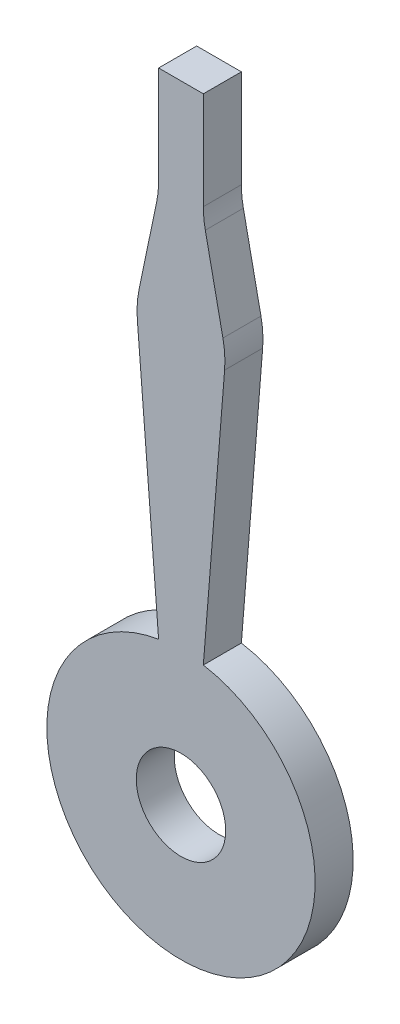
from build123d import *

# Parameters (mm, degrees)
BOSS_EXTRUDE1_DEPTH = 4


with BuildPart() as part:
    # Sketch1 → Boss-Extrude1 (new body)
    with BuildSketch(Plane.XY):
        with BuildLine():
            ThreePointArc((0, 4.7), (3.323401872, 3.323401872), (4.7, 0))
            ThreePointArc((4.7, 0), (3.323401872, -3.323401872), (0, -4.7))
            Line((0, -4.7), (0, -14.1))
            ThreePointArc((0, -14.1), (9.970205615, -9.970205615), (14.1, 0))
            ThreePointArc((14.1, 0), (11.512601791, 8.140638796), (4.7, 13.293607486))
            ThreePointArc((4.7, 13.293607486), (3.538135112, 13.648868082), (2.35, 13.90278749))
            ThreePointArc((2.35, 13.90278749), (1.17913027, 14.050610371), (0, 14.1))
            Line((0, 14.1), (0, 4.7))
        make_face()
        with BuildLine():
            Line((0, -14.1), (0, -4.7))
            ThreePointArc((0, -4.7), (-4.7, 0), (0, 4.7))
            Line((0, 4.7), (0, 14.1))
            ThreePointArc((0, 14.1), (-1.17913027, 14.050610371), (-2.35, 13.90278749))
            ThreePointArc((-2.35, 13.90278749), (-3.538135112, 13.648868082), (-4.7, 13.293607486))
            ThreePointArc((-4.7, 13.293607486), (-13.896939691, -2.3843379), (0, -14.1))
        make_face()
        with BuildLine():
            ThreePointArc((-2.35, 13.90278749), (-1.17913027, 14.050610371), (0, 14.1))
            Line((0, 14.1), (0, 65.9))
            Line((0, 65.9), (-2.35, 65.9))
            Line((-2.35, 65.9), (-2.35, 55.625335767))
            ThreePointArc((-2.35, 55.625335767), (-2.402477907, 54.602201264), (-2.559360842, 53.589805153))
            Line((-2.559360842, 53.589805153), (-4.408193437, 44.697159337))
            ThreePointArc((-4.408193437, 44.697159337), (-4.597967377, 43.28721197), (-4.585741176, 41.864603012))
            Line((-4.585741176, 41.864603012), (-2.35, 13.90278749))
        make_face()
        with BuildLine():
            Line((0, 65.9), (0, 14.1))
            ThreePointArc((0, 14.1), (1.17913027, 14.050610371), (2.35, 13.90278749))
            Line((2.35, 13.90278749), (4.585741176, 41.864603012))
            ThreePointArc((4.585741176, 41.864603012), (4.597967377, 43.28721197), (4.408193437, 44.697159337))
            Line((4.408193437, 44.697159337), (2.559360842, 53.589805153))
            ThreePointArc((2.559360842, 53.589805153), (2.402477907, 54.602201264), (2.35, 55.625335767))
            Line((2.35, 55.625335767), (2.35, 65.9))
            Line((2.35, 65.9), (0, 65.9))
        make_face()
    extrude(amount=BOSS_EXTRUDE1_DEPTH)


solid = part.part
